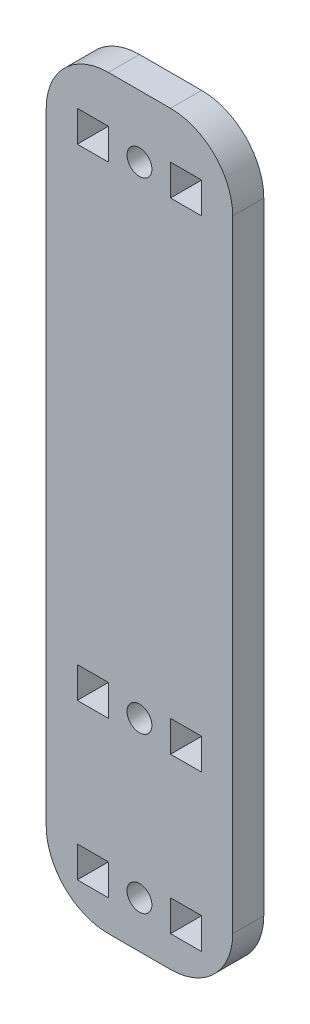
from build123d import *

# Parameters (mm, degrees)
ESQUISSE1_W        = 30
ESQUISSE1_H        = 120
ESQUISSE1_R        = 2
ESQUISSE1_W_2      = 5
ESQUISSE1_H_2      = 5
BOSS_EXTRU_1_DEPTH = 5
CONG_1_R           = 10


with BuildPart() as part:
    # Esquisse1 → Boss.-Extru.1 (new body)
    with BuildSketch(Plane.XY):
        with Locations((-15, -60)):
            Rectangle(ESQUISSE1_W, ESQUISSE1_H)
        with Locations((-15, -10)):
            Circle(ESQUISSE1_R, mode=Mode.SUBTRACT)
        with Locations((-15, -87.5)):
            Circle(ESQUISSE1_R, mode=Mode.SUBTRACT)
        with Locations((-15, -112.5)):
            Circle(ESQUISSE1_R, mode=Mode.SUBTRACT)
        with Locations((-22.5, -10)):
            Rectangle(ESQUISSE1_W_2, ESQUISSE1_H_2, mode=Mode.SUBTRACT)
        with Locations((-7.5, -112.5)):
            Rectangle(ESQUISSE1_W_2, ESQUISSE1_H_2, mode=Mode.SUBTRACT)
        with Locations((-22.5, -112.5)):
            Rectangle(ESQUISSE1_W_2, ESQUISSE1_H_2, mode=Mode.SUBTRACT)
        with Locations((-22.5, -87.5)):
            Rectangle(ESQUISSE1_W_2, ESQUISSE1_H_2, mode=Mode.SUBTRACT)
        with Locations((-7.5, -87.5)):
            Rectangle(ESQUISSE1_W_2, ESQUISSE1_H_2, mode=Mode.SUBTRACT)
        with Locations((-7.5, -10)):
            Rectangle(ESQUISSE1_W_2, ESQUISSE1_H_2, mode=Mode.SUBTRACT)
    extrude(amount=BOSS_EXTRU_1_DEPTH)

    # Congé1
    cong_1_edges = [part.edges().sort_by_distance(p)[0] for p in [
        (-30, 0, 2.5),
        (0, 0, 2.5),
        (0, -120, 2.5),
        (-30, -120, 2.5),
    ]]
    fillet(cong_1_edges, radius=CONG_1_R)


solid = part.part
